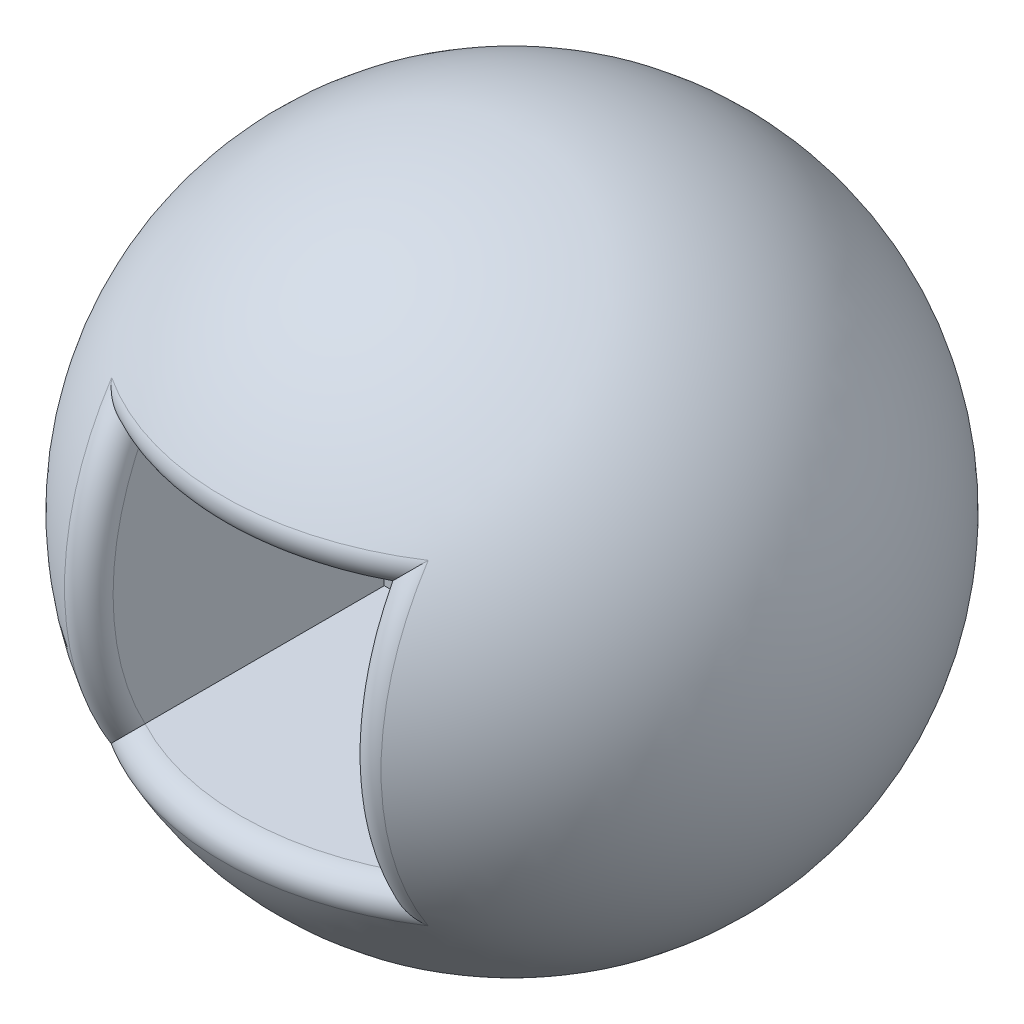
from build123d import *

# Parameters (mm, degrees)
SKETCH_2_W          = 6.2
SKETCH_2_H          = 6.2
CUT_EXTRUDE_1_DEPTH = 8
FILLET_1_R          = 0.5


with BuildPart() as part:
    # 스케치1 → 회전2 (revolve)
    with BuildSketch(Plane.XY):
        with BuildLine():
            Line((0, 8), (0, -8))
            ThreePointArc((0, -8), (8, 0), (0, 8))
        make_face()
    revolve(axis=Axis((0, 8, 0), (0, -1, 0)))

    # 스케치2 → 컷-돌출1 (cut)
    with BuildSketch(Plane.XY.offset(8)):
        Rectangle(SKETCH_2_W, SKETCH_2_H)
    extrude(amount=-CUT_EXTRUDE_1_DEPTH, mode=Mode.SUBTRACT)

    # 필렛1
    fillet_1_edges = [part.edges().sort_by_distance(p)[0] for p in [
        (0, -3.1, 7.374957627),
        (3.1, 0, 7.374957627),
        (0, 3.1, 7.374957627),
        (-3.1, 0, 7.374957627),
    ]]
    fillet(fillet_1_edges, radius=FILLET_1_R)


solid = part.part
